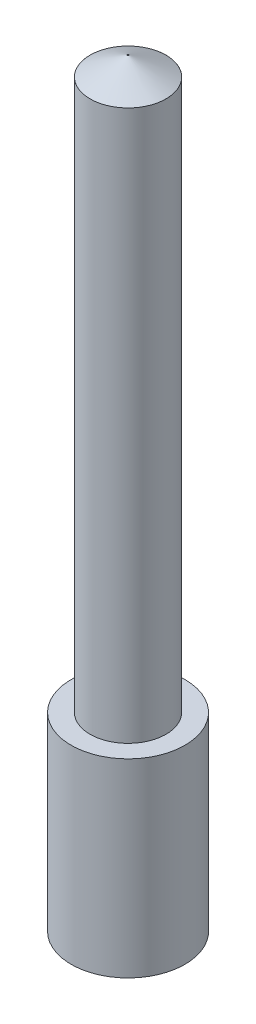
from build123d import *

# Parameters (mm, degrees)
SZKIC1_R                    = 10
DODANIE_WYCI_GNI_CIE1_DEPTH = 195
SZKIC2_R                    = 10
DODANIE_WYCI_GNI_CIE2_DEPTH = 5
DODANIE_WYCI_GNI_CIE2_TAPER = 63
SZKIC3_R                    = 15
DODANIE_WYCI_GNI_CIE3_DEPTH = 50


with BuildPart() as part:
    # Szkic1 → Dodanie-wyciągnięcie1 (new body)
    with BuildSketch(Plane(origin=(0, 0, 0), x_dir=(1, 0, 0), z_dir=(0, 1, 0))):
        with Locations(Location((0, 0, 0), (0, 0, 270))):
            Circle(SZKIC1_R)
    extrude(amount=DODANIE_WYCI_GNI_CIE1_DEPTH)

    # Szkic3 → Dodanie-wyciągnięcie3 (add)
    with BuildSketch(Plane.XZ):
        with Locations(Location((0, 0, 0), (0, 0, 270))):
            Circle(SZKIC3_R)
    extrude(amount=-DODANIE_WYCI_GNI_CIE3_DEPTH)


with BuildPart() as body_2:
    # Szkic2 → Dodanie-wyciągnięcie2 (new body)
    with BuildSketch(Plane(origin=(0, 195, 0), x_dir=(1, 0, 0), z_dir=(0, 1, 0))):
        with Locations(Location((0, 0, 0), (0, 0, 270))):
            Circle(SZKIC2_R)
    extrude(amount=DODANIE_WYCI_GNI_CIE2_DEPTH, taper=DODANIE_WYCI_GNI_CIE2_TAPER)


solid = Compound([part.part, body_2.part])
